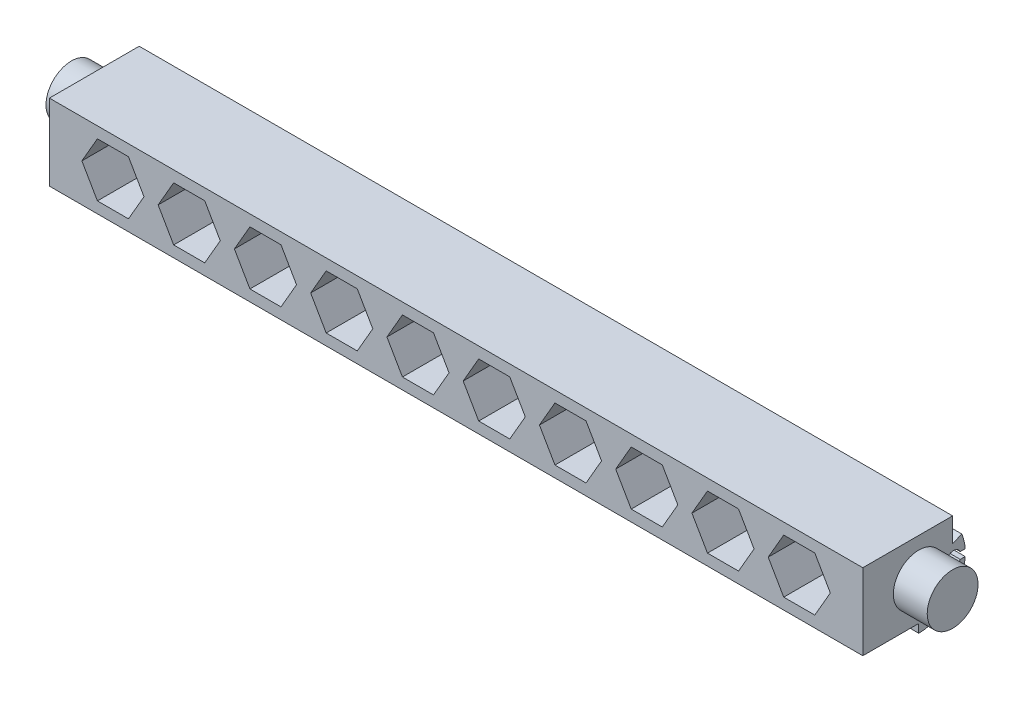
from build123d import *

# Parameters (mm, degrees)
SKETCH1_W           = 9
SKETCH1_H           = 9
BOSS_EXTRUDE1_DEPTH = 1.6
BOSS_EXTRUDE2_START = 1.6
SKETCH1_3_W         = 9
SKETCH1_3_H         = 9
SKETCH1_3_R         = 3.175
BOSS_EXTRUDE2_DEPTH = 0.5
BOSS_EXTRUDE3_START = 2.1
SKETCH1_4_W         = 9
SKETCH1_4_H         = 9
BOSS_EXTRUDE3_DEPTH = 8.5
LPATTERN12_COUNT    = 10
LPATTERN12_PITCH    = 9
BOSS_EXTRUDE4_DEPTH = 3
SKETCH2_3_R         = 3
BOSS_EXTRUDE5_DEPTH = 7
BOSS_EXTRUDE6_START = -1
BOSS_EXTRUDE6_DEPTH = 1
CUT_EXTRUDE3_START  = -1
CUT_EXTRUDE3_DEPTH  = 1
CUT_EXTRUDE1_DEPTH  = 4
CUT_EXTRUDE2_DEPTH  = 4


with BuildPart() as part:
    # Sketch1 → Boss-Extrude1 (new body)
    # profile 1 of 7: a face of its own
    with BuildSketch(Plane.XY):
        Rectangle(SKETCH1_W, SKETCH1_H)
        Polygon((1.833087105, -3.175), (3.666174209, 0), (1.833087105, 3.175), (-1.833087105, 3.175), (-3.666174209, 0), (-1.833087105, -3.175), align=None, mode=Mode.SUBTRACT)
    # profile 2 of 7: a face of its own
    with BuildSketch(Plane.XY):
        with BuildLine():
            ThreePointArc((0, 3.175), (1.587499917, 2.749630705), (2.749630561, 1.587500167))
            Line((2.749630561, 1.587500167), (1.833087105, 3.175))
            Line((1.833087105, 3.175), (0, 3.175))
        make_face()
    # profile 3 of 7: a face of its own
    with BuildSketch(Plane.XY):
        with BuildLine():
            ThreePointArc((-2.749630541, 1.587500201), (-1.5874999, 2.749630715), (0, 3.175))
            Line((0, 3.175), (-1.833087105, 3.175))
            Line((-1.833087105, 3.175), (-2.749630541, 1.587500201))
        make_face()
    # profile 4 of 7: a face of its own
    with BuildSketch(Plane.XY):
        with BuildLine():
            ThreePointArc((-2.749630553, -1.58750018), (-3.175, 1.2e-08), (-2.749630541, 1.587500201))
            Line((-2.749630541, 1.587500201), (-3.666174209, 0))
            Line((-3.666174209, 0), (-2.749630553, -1.58750018))
        make_face()
    # profile 5 of 7: a face of its own
    with BuildSketch(Plane.XY):
        with BuildLine():
            Line((2.749630581, -1.587500132), (3.666174209, 0))
            Line((3.666174209, 0), (2.749630561, 1.587500167))
            ThreePointArc((2.749630561, 1.587500167), (3.066814474, 0.821750561), (3.175, 0))
            ThreePointArc((3.175, 0), (3.066814479, -0.821750542), (2.749630581, -1.587500132))
        make_face()
    # profile 6 of 7: a face of its own
    with BuildSketch(Plane.XY):
        with BuildLine():
            Line((1.833087105, -3.175), (2.749630581, -1.587500132))
            ThreePointArc((2.749630581, -1.587500132), (1.587499935, -2.749630694), (4e-09, -3.175))
            Line((4e-09, -3.175), (1.833087105, -3.175))
        make_face()
    # profile 7 of 7: a face of its own
    with BuildSketch(Plane.XY):
        with BuildLine():
            Line((-1.833087105, -3.175), (4e-09, -3.175))
            ThreePointArc((4e-09, -3.175), (-1.587499909, -2.74963071), (-2.749630553, -1.58750018))
            Line((-2.749630553, -1.58750018), (-1.833087105, -3.175))
        make_face()
    boss_extrude1 = extrude(amount=BOSS_EXTRUDE1_DEPTH)

    # Sketch1<3> → Boss-Extrude2 (add)
    # profile 1 of 8: a face of its own
    with BuildSketch(Plane.XY.offset(BOSS_EXTRUDE2_START)):
        Rectangle(SKETCH1_3_W, SKETCH1_3_H)
        Polygon((1.833087105, -3.175), (3.666174209, 0), (1.833087105, 3.175), (-1.833087105, 3.175), (-3.666174209, 0), (-1.833087105, -3.175), align=None, mode=Mode.SUBTRACT)
    # profile 2 of 8: a face of its own
    with BuildSketch(Plane.XY.offset(BOSS_EXTRUDE2_START)):
        Circle(SKETCH1_3_R)
    # profile 3 of 8: a face of its own
    with BuildSketch(Plane.XY.offset(BOSS_EXTRUDE2_START)):
        with BuildLine():
            ThreePointArc((0, 3.175), (1.587499917, 2.749630705), (2.749630561, 1.587500167))
            Line((2.749630561, 1.587500167), (1.833087105, 3.175))
            Line((1.833087105, 3.175), (0, 3.175))
        make_face()
    # profile 4 of 8: a face of its own
    with BuildSketch(Plane.XY.offset(BOSS_EXTRUDE2_START)):
        with BuildLine():
            Line((2.749630581, -1.587500132), (3.666174209, 0))
            Line((3.666174209, 0), (2.749630561, 1.587500167))
            ThreePointArc((2.749630561, 1.587500167), (3.066814474, 0.821750561), (3.175, 0))
            ThreePointArc((3.175, 0), (3.066814479, -0.821750542), (2.749630581, -1.587500132))
        make_face()
    # profile 5 of 8: a face of its own
    with BuildSketch(Plane.XY.offset(BOSS_EXTRUDE2_START)):
        with BuildLine():
            Line((1.833087105, -3.175), (2.749630581, -1.587500132))
            ThreePointArc((2.749630581, -1.587500132), (1.587499935, -2.749630694), (4e-09, -3.175))
            Line((4e-09, -3.175), (1.833087105, -3.175))
        make_face()
    # profile 6 of 8: a face of its own
    with BuildSketch(Plane.XY.offset(BOSS_EXTRUDE2_START)):
        with BuildLine():
            Line((-1.833087105, -3.175), (4e-09, -3.175))
            ThreePointArc((4e-09, -3.175), (-1.587499909, -2.74963071), (-2.749630553, -1.58750018))
            Line((-2.749630553, -1.58750018), (-1.833087105, -3.175))
        make_face()
    # profile 7 of 8: a face of its own
    with BuildSketch(Plane.XY.offset(BOSS_EXTRUDE2_START)):
        with BuildLine():
            ThreePointArc((-2.749630553, -1.58750018), (-3.175, 1.2e-08), (-2.749630541, 1.587500201))
            Line((-2.749630541, 1.587500201), (-3.666174209, 0))
            Line((-3.666174209, 0), (-2.749630553, -1.58750018))
        make_face()
    # profile 8 of 8: a face of its own
    with BuildSketch(Plane.XY.offset(BOSS_EXTRUDE2_START)):
        with BuildLine():
            ThreePointArc((-2.749630541, 1.587500201), (-1.5874999, 2.749630715), (0, 3.175))
            Line((0, 3.175), (-1.833087105, 3.175))
            Line((-1.833087105, 3.175), (-2.749630541, 1.587500201))
        make_face()
    boss_extrude2 = extrude(amount=BOSS_EXTRUDE2_DEPTH)

    # Sketch1<4> → Boss-Extrude3 (add)
    with BuildSketch(Plane.XY.offset(BOSS_EXTRUDE3_START)):
        Rectangle(SKETCH1_4_W, SKETCH1_4_H)
        Polygon((1.833087105, -3.175), (3.666174209, 0), (1.833087105, 3.175), (-1.833087105, 3.175), (-3.666174209, 0), (-1.833087105, -3.175), align=None, mode=Mode.SUBTRACT)
    boss_extrude3 = extrude(amount=BOSS_EXTRUDE3_DEPTH)

    # LPattern12: Boss-Extrude1, Boss-Extrude2, Boss-Extrude3 ×10
    with Locations(*[(i * LPATTERN12_PITCH, 0, 0) for i in range(1, LPATTERN12_COUNT)]):
        add(boss_extrude1)
        add(boss_extrude2)
        add(boss_extrude3)

    # Sketch2 → Boss-Extrude4 (add)
    with BuildSketch(Plane.ZY.offset(4.5)):
        with BuildLine():
            Line((5.863961031, -4.5), (10.6, -4.5))
            Line((10.6, -4.5), (10.6, 4.5))
            Line((10.6, 4.5), (0, 4.5))
            Line((0, 4.5), (0, 1.656854249))
            Line((0, 1.656854249), (-1.081337429, 2.104758878))
            ThreePointArc((-1.081337429, 2.104758878), (0.110912703, -3.889087297), (6.104758878, -5.081337429))
            Line((6.104758878, -5.081337429), (5.863961031, -4.5))
        make_face()
    boss_extrude4 = extrude(amount=BOSS_EXTRUDE4_DEPTH)

    # Sketch2<3> → Boss-Extrude5 (add)
    with BuildSketch(Plane.ZY.offset(4.5)):
        with Locations((4, 0)):
            Circle(SKETCH2_3_R)
    boss_extrude5 = extrude(amount=BOSS_EXTRUDE5_DEPTH)

    # Sketch2<4> → Boss-Extrude6 (add)
    with BuildSketch(Plane.ZY.offset(4.5).offset(BOSS_EXTRUDE6_START)):
        with BuildLine():
            Line((6.104758878, -5.081337429), (5.863961031, -4.5))
            Line((5.863961031, -4.5), (0.83772234, -4.5))
            ThreePointArc((0.83772234, -4.5), (3.396613892, -5.4668021), (6.104758878, -5.081337429))
        make_face()
        with BuildLine():
            Line((0, -3.774917218), (0, 1.656854249))
            Line((0, 1.656854249), (-1.081337429, 2.104758878))
            ThreePointArc((-1.081337429, 2.104758878), (-1.409280925, -0.994826557), (0, -3.774917218))
        make_face()
    boss_extrude6 = extrude(amount=BOSS_EXTRUDE6_DEPTH)

    # Sketch2<5> → Cut-Extrude3 (cut)
    with BuildSketch(Plane.ZY.offset(4.5).offset(CUT_EXTRUDE3_START)):
        with BuildLine():
            ThreePointArc((0.83772234, -4.5), (0.400556768, -4.158606548), (0, -3.774917218))
            Line((0, -3.774917218), (0, -4.5))
            Line((0, -4.5), (0.83772234, -4.5))
        make_face()
    cut_extrude3 = extrude(amount=CUT_EXTRUDE3_DEPTH, mode=Mode.SUBTRACT)

    # Mirror1: Boss-Extrude4, Boss-Extrude5, Boss-Extrude6, Cut-Extrude3 across plane
    add(boss_extrude4.mirror(Plane.ZY.offset(-40.5)))
    add(boss_extrude5.mirror(Plane.ZY.offset(-40.5)))
    add(boss_extrude6.mirror(Plane.ZY.offset(-40.5)))
    add(cut_extrude3.mirror(Plane.ZY.offset(-40.5)), mode=Mode.SUBTRACT)

    # Sketch4 → Cut-Extrude1 (cut)
    with BuildSketch(Plane.ZY.offset(7.5)):
        with BuildLine():
            ThreePointArc((4.4, -4.9), (4, -3.193774225), (3.6, -4.9))
            Line((3.6, -4.9), (4.4, -4.9))
        make_face()
        with BuildLine():
            Line((4.4, -4.9), (3.6, -4.9))
            Line((3.6, -4.9), (3.6, -5.485435261))
            ThreePointArc((3.6, -5.485435261), (4, -5.5), (4.4, -5.485435261))
            Line((4.4, -5.485435261), (4.4, -4.9))
        make_face()
        with BuildLine():
            ThreePointArc((-1.081337429, 2.104758878), (-1.394319042, 1.072996771), (-1.5, 0))
            Line((-1.5, 0), (0, 0))
            Line((0, 0), (0, 1.656854249))
            Line((0, 1.656854249), (-1.081337429, 2.104758878))
        make_face()
    extrude(amount=-CUT_EXTRUDE1_DEPTH, mode=Mode.SUBTRACT)

    # Sketch7 → Cut-Extrude2 (cut)
    with BuildSketch(Plane(origin=(88.5, 0, 0), x_dir=(0, 0, -1), z_dir=(1, 0, 0))):
        with BuildLine():
            Line((1.485435261, 0.4), (0.9, 0.4))
            Line((0.9, 0.4), (0.9, -0.4))
            Line((0.9, -0.4), (1.485435261, -0.4))
            ThreePointArc((1.485435261, -0.4), (1.5, 0), (1.485435261, 0.4))
        make_face()
        with BuildLine():
            Line((0.9, 0.4), (0.9, -0.4))
            ThreePointArc((0.9, -0.4), (-0.806225775, 0), (0.9, 0.4))
        make_face()
        with BuildLine():
            ThreePointArc((-6.104758878, -5.081337429), (-5.072996771, -5.394319042), (-4, -5.5))
            Line((-4, -5.5), (-4, -4.5))
            Line((-4, -4.5), (-5.863961031, -4.5))
            Line((-5.863961031, -4.5), (-6.104758878, -5.081337429))
        make_face()
    extrude(amount=-CUT_EXTRUDE2_DEPTH, mode=Mode.SUBTRACT)


solid = part.part
